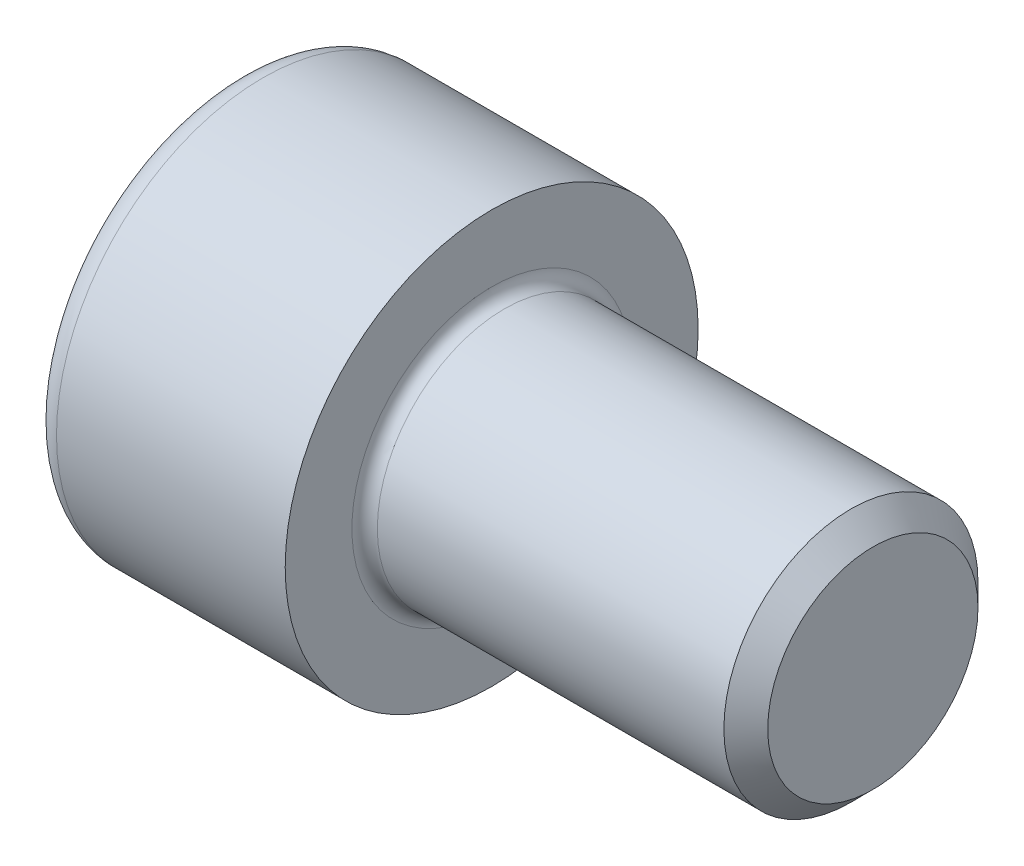
from build123d import *

# Parameters (mm, degrees)
FILLET1_R   = 0.4
FILLET2_R   = 0.8
HEX_2_DEPTH = 4


with BuildPart() as part:
    # BodySke → Base-Revolve (revolve)
    with BuildSketch(Plane.XY, mode=Mode.PRIVATE) as base_revolve_sk:
        Polygon((0, 0), (0, 6.5), (8, 6.5), (8, 4), (19.3095, 4), (20, 3.3095), (20, 0), align=None)
    revolve(base_revolve_sk.sketch.rotate(Axis((-31.75, 0, 0), (1, 0, 0)), 90), axis=Axis((-31.75, 0, 0), (1, 0, 0)))

    # Fillet1
    fillet1_edges = [part.edges().sort_by_distance(p)[0] for p in [
        (8, 0, -4),
    ]]
    fillet(fillet1_edges, radius=FILLET1_R)

    # Fillet2
    fillet2_edges = [part.edges().sort_by_distance(p)[0] for p in [
        (0, 0, -6.5),
    ]]
    fillet(fillet2_edges, radius=FILLET2_R)

    # Sketch2 → Hex-PreBroach (revolve, cut)
    with BuildSketch(Plane.XY, mode=Mode.PRIVATE) as hex_prebroach_sk:
        Polygon((0, 3.01), (4, 3.01), (5.73782431, 0), (0, 0), align=None)
    revolve(hex_prebroach_sk.sketch.rotate(Axis((0, 0, 0), (1, 0, 0)), 90), axis=Axis((0, 0, 0), (1, 0, 0)), mode=Mode.SUBTRACT)

    # Sketch3 → Hex 2 (cut)
    with BuildSketch(Plane(origin=(0, 0, 0), x_dir=(0, 0.500000000000001, 0.866025403784438), z_dir=(-1, 0, 0))):
        Polygon((1.73782431, 3.01), (-1.73782431, 3.01), (-3.475648621, 0), (-1.73782431, -3.01), (1.73782431, -3.01), (3.475648621, 0), align=None)
    extrude(amount=-HEX_2_DEPTH, mode=Mode.SUBTRACT)


solid = part.part
